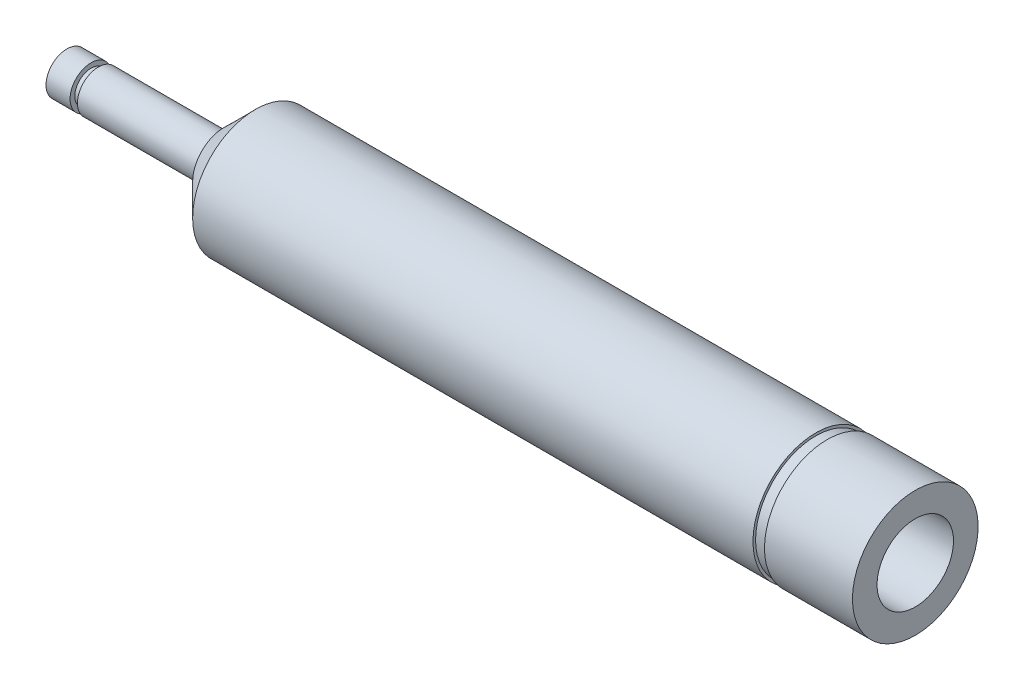
from build123d import *

# Parameters (mm, degrees)
PER_AGE1_D           = 5.5
PER_AGE1_DEPTH       = 35
PER_AGE1_CBORE_D     = 7.3
PER_AGE1_CBORE_DEPTH = 13
PER_AGE1_TIP         = 1.58771324


with BuildPart() as part:
    # Esquisse1 → Base-Révolution (revolve)
    with BuildSketch(Plane.XY, mode=Mode.PRIVATE) as base_r_volution_sk:
        Polygon((0, 0), (0, 6), (-8.4, 6), (-8.4, 5.75), (-9.5, 5.75), (-9.5, 6), (-63, 6), (-66, 3), (-66, 2), (-78, 2), (-78, 1.55), (-78.7, 1.55), (-78.7, 2), (-81, 2), (-81, 0), align=None)
    revolve(base_r_volution_sk.sketch.rotate(Axis((-95.795789587, 0, 0), (1, 0, 0)), 90), axis=Axis((-95.795789587, 0, 0), (1, 0, 0)))

    # Perçage1
    with Locations(Plane(origin=(0, 0, 0), x_dir=(0, 0, -1), z_dir=(1, 0, 0))):
        with Locations((0, 0)):
            CounterBoreHole(PER_AGE1_D / 2, PER_AGE1_CBORE_D / 2, PER_AGE1_CBORE_DEPTH, depth=PER_AGE1_DEPTH)
            with Locations((0, 0, -(PER_AGE1_DEPTH + PER_AGE1_TIP / 2))):  # 120° drill point
                Cone(0, PER_AGE1_D / 2, PER_AGE1_TIP, mode=Mode.SUBTRACT)


solid = part.part
